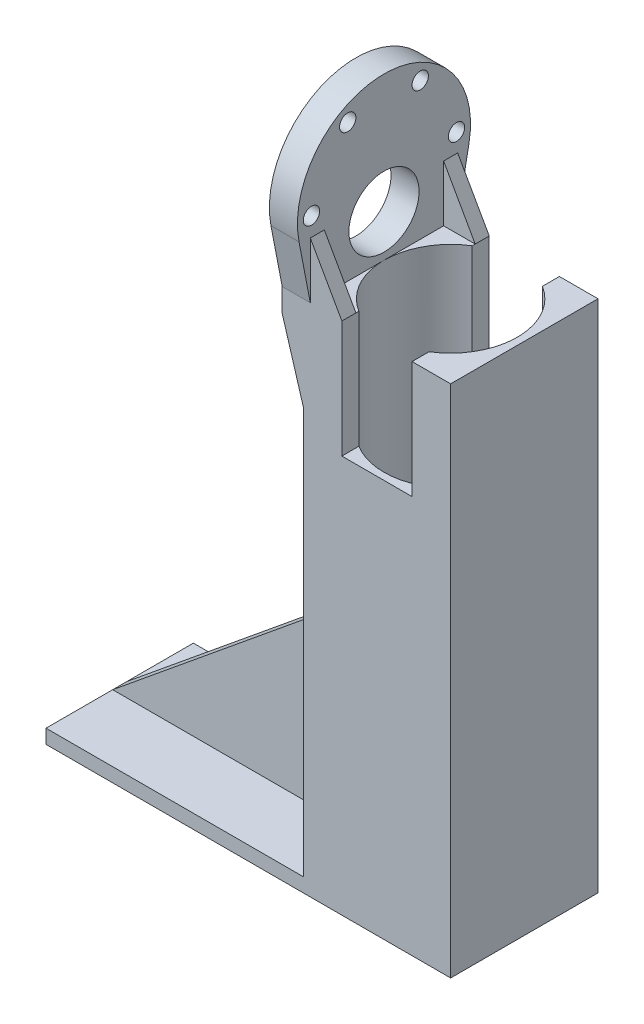
from build123d import *

# Parameters (mm, degrees)
SKETCH1_W           = 31.5
SKETCH1_H           = 31.5
BOSS_EXTRUDE1_DEPTH = 110
SKETCH2_R           = 14.25
CUT_EXTRUDE1_DEPTH  = 108
BOSS_EXTRUDE2_DEPTH = 1.5
BOSS_EXTRUDE3_DEPTH = 1.5
BOSS_EXTRUDE4_DEPTH = 31.5
SKETCH10_W          = 31.5
SKETCH10_H          = 3
BOSS_EXTRUDE5_DEPTH = 55
SKETCH9_W           = 15
SKETCH9_H           = 31.5
CUT_EXTRUDE4_DEPTH  = 25
BOSS_EXTRUDE6_DEPTH = 1.5
BOSS_EXTRUDE7_DEPTH = 3
BOSS_EXTRUDE8_DEPTH = 3
BOSS_EXTRUDE9_START = 4.5
BOSS_EXTRUDE9_DEPTH = 4.5
SKETCH7_R           = 1.75
SKETCH7_R_2         = 7.5
CUT_EXTRUDE3_DEPTH  = 17.25


with BuildPart() as part:
    # Sketch1 → Boss-Extrude1 (new body)
    with BuildSketch(Plane(origin=(0, 0, 0), x_dir=(1, 0, 0), z_dir=(0, 1, 0))):
        with Locations((15.75, -15.75)):
            Rectangle(SKETCH1_W, SKETCH1_H)
    extrude(amount=BOSS_EXTRUDE1_DEPTH)

    # Sketch2 → Cut-Extrude1 (cut)
    with BuildSketch(Plane(origin=(0, 110, 0), x_dir=(1, 0, 0), z_dir=(0, 1, 0))):
        with Locations(Location((15.75, -15.75, 0), (0, 0, 270))):
            Circle(SKETCH2_R)
    extrude(amount=-CUT_EXTRUDE1_DEPTH, mode=Mode.SUBTRACT)

    # Sketch4 → Boss-Extrude2 (add)
    with BuildSketch(Plane.ZY):
        with BuildLine():
            Line((33.91386173, 122.48942639), (31.5, 110))
            Line((31.5, 110), (25.037087811, 110))
            ThreePointArc((25.037087811, 110), (15.75, 107.5), (6.462912189, 110))
            Line((6.462912189, 110), (0, 110))
            Line((0, 110), (-2.41386173, 122.48942639))
            ThreePointArc((-2.41386173, 122.48942639), (15.75, 144.5), (33.91386173, 122.48942639))
        make_face()
    extrude(amount=-BOSS_EXTRUDE2_DEPTH)

    # Sketch4<3> → Boss-Extrude3 (add)
    with BuildSketch(Plane.ZY):
        with BuildLine():
            Line((33.91386173, 122.48942639), (31.5, 110))
            Line((31.5, 110), (25.037087811, 110))
            ThreePointArc((25.037087811, 110), (15.75, 107.5), (6.462912189, 110))
            Line((6.462912189, 110), (0, 110))
            Line((0, 110), (-2.41386173, 122.48942639))
            ThreePointArc((-2.41386173, 122.48942639), (15.75, 144.5), (33.91386173, 122.48942639))
        make_face()
    extrude(amount=-BOSS_EXTRUDE3_DEPTH)

    # Sketch6 → Boss-Extrude4 (add)
    with BuildSketch(Plane.XY.offset(31.5)):
        Polygon((0, 90), (0, 110), (-4.5, 110), (-4.5, 105), align=None)
    extrude(amount=-BOSS_EXTRUDE4_DEPTH)

    # Sketch10 → Boss-Extrude5 (add)
    with BuildSketch(Plane.ZY):
        with Locations((15.75, 1.5)):
            Rectangle(SKETCH10_W, SKETCH10_H)
    extrude(amount=BOSS_EXTRUDE5_DEPTH)

    # Sketch9 → Cut-Extrude4 (cut)
    with BuildSketch(Plane(origin=(0, 110, 0), x_dir=(1, 0, 0), z_dir=(0, 1, 0))):
        with Locations((15.75, -15.75)):
            Rectangle(SKETCH9_W, SKETCH9_H)
    extrude(amount=-CUT_EXTRUDE4_DEPTH, mode=Mode.SUBTRACT)

    # Sketch14 → Boss-Extrude6 (add, symmetric)
    with BuildSketch(Plane(origin=(0, 0, 15.75), x_dir=(-1, 0, 0), z_dir=(0, 0, -1))):
        Polygon((55, 3), (0, 48), (0, 3), align=None)
    extrude(amount=BOSS_EXTRUDE6_DEPTH, both=True)

    # Sketch15 → Boss-Extrude7 (add)
    with BuildSketch(Plane.XY.offset(31.5)):
        Polygon((8.25, 110), (1.5, 110), (1.5, 122), align=None)
    extrude(amount=-BOSS_EXTRUDE7_DEPTH)

    # Sketch16 → Boss-Extrude8 (add)
    with BuildSketch(Plane(origin=(0, 0, 0), x_dir=(-1, 0, 0), z_dir=(0, 0, -1))):
        Polygon((-8.25, 110), (-1.5, 110), (-1.5, 122), align=None)
    extrude(amount=-BOSS_EXTRUDE8_DEPTH)

    # Sketch4<4> → Boss-Extrude9 (add)
    with BuildSketch(Plane.ZY.offset(BOSS_EXTRUDE9_START)):
        with BuildLine():
            Line((33.91386173, 122.48942639), (31.5, 110))
            Line((31.5, 110), (25.037087811, 110))
            ThreePointArc((25.037087811, 110), (15.75, 107.5), (6.462912189, 110))
            Line((6.462912189, 110), (0, 110))
            Line((0, 110), (-2.41386173, 122.48942639))
            ThreePointArc((-2.41386173, 122.48942639), (15.75, 144.5), (33.91386173, 122.48942639))
        make_face()
    extrude(amount=-BOSS_EXTRUDE9_DEPTH)

    # Sketch7 → Cut-Extrude3 (cut, symmetric)
    with BuildSketch(Plane(origin=(1.5, 0, 0), x_dir=(0, 0, -1), z_dir=(1, 0, 0))):
        with Locations(Location((-31.25, 126, 0), (0, 0, 270))):
            Circle(SKETCH7_R)
        with Locations(Location((-23.5, 139.423393759, 0), (0, 0, 270))):
            Circle(SKETCH7_R)
        with Locations(Location((-8, 139.423393759, 0), (0, 0, 270))):
            Circle(SKETCH7_R)
        with Locations(Location((-0.25, 126, 0), (0, 0, 270))):
            Circle(SKETCH7_R)
        with Locations(Location((-15.75, 119, 0), (0, 0, 270))):
            Circle(SKETCH7_R_2)
    extrude(amount=CUT_EXTRUDE3_DEPTH, both=True, mode=Mode.SUBTRACT)


solid = part.part
